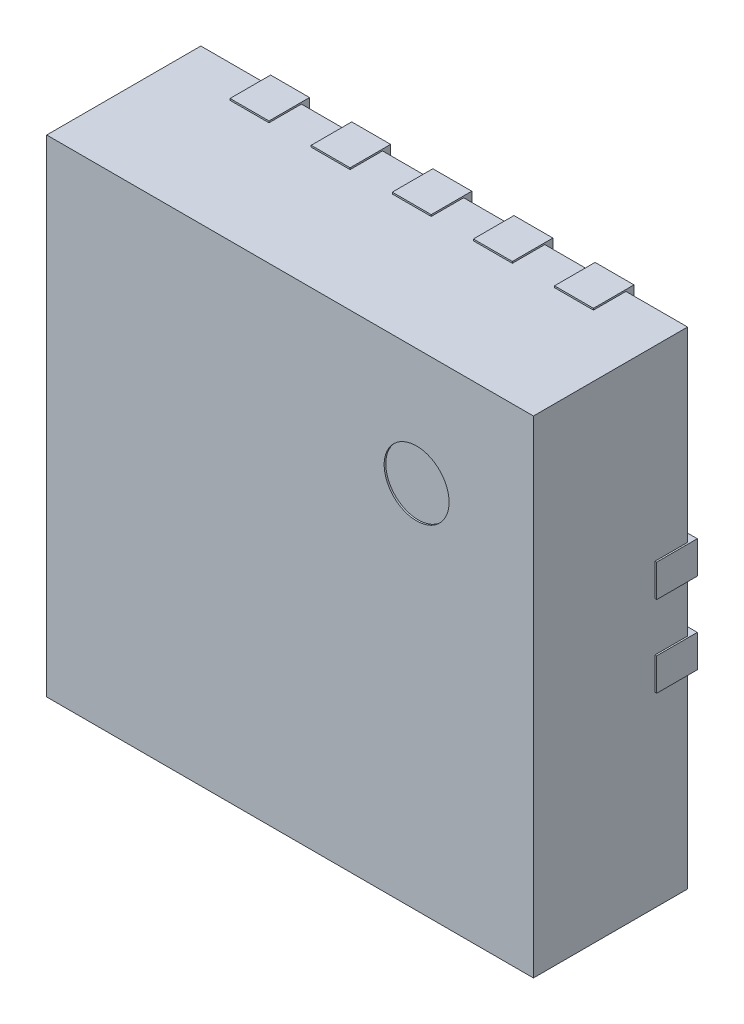
from build123d import *

# Parameters (mm, degrees)
SKETCH1_W                = 3
SKETCH1_H                = 3
BOSS_EXTRUDE1_DEPTH      = 0.95
SKETCH2_R                = 0.2
CUT_EXTRUDE1_DEPTH       = 0.01
BOSS_EXTRUDE2_DEPTH      = 0.05
BOSS_EXTRUDE2_DEPTH_BACK = 0.2
SKETCH3_W                = 0.01
SKETCH3_H                = 0.2
BOSS_EXTRUDE4_START      = -0.2
BOSS_EXTRUDE4_DEPTH      = 0.25
LPATTERN2_COUNT          = 5
LPATTERN2_PITCH          = 0.5
MIRROR2_START            = -0.2
MIRROR2_COPY_1_DEPTH     = 0.25
MIRROR2_COPY_2_DEPTH     = 0.25
MIRROR2_COPY_3_DEPTH     = 0.25
MIRROR2_COPY_4_DEPTH     = 0.25


with BuildPart() as part:
    # Sketch1 → Boss-Extrude1 (new body)
    with BuildSketch(Plane.XY):
        Rectangle(SKETCH1_W, SKETCH1_H)
    extrude(amount=BOSS_EXTRUDE1_DEPTH)

    # Sketch2 → Cut-Extrude1 (cut)
    with BuildSketch(Plane.XY.offset(0.95)):
        with Locations((0.78, 0.78)):
            Circle(SKETCH2_R)
    extrude(amount=-CUT_EXTRUDE1_DEPTH, mode=Mode.SUBTRACT)

    # Sketch3 → Boss-Extrude2 (add, two sides: drawn at the far end of the back side and taken through both)
    with BuildSketch(Plane(origin=(0, 0, 0), x_dir=(-1, 0, 0), z_dir=(0, 0, -1)).offset(-BOSS_EXTRUDE2_DEPTH_BACK)):
        with BuildLine():
            Line((1.5, 0.35), (1.2, 0.35))
            Line((1.2, 0.35), (1.2, 0.80475))
            ThreePointArc((1.2, 0.80475), (1.194068912, 0.819068912), (1.17975, 0.825))
            Line((1.17975, 0.825), (-1, 0.825))
            Line((-1, 0.825), (-1.2, 0.625))
            Line((-1.2, 0.625), (-1.2, 0.35))
            Line((-1.2, 0.35), (-1.5, 0.35))
            Line((-1.5, 0.35), (-1.5, 0.15))
            Line((-1.5, 0.15), (-1.2, 0.15))
            Line((-1.2, 0.15), (-1.2, -0.15))
            Line((-1.2, -0.15), (-1.5, -0.15))
            Line((-1.5, -0.15), (-1.5, -0.35))
            Line((-1.5, -0.35), (-1.2, -0.35))
            Line((-1.2, -0.35), (-1.2, -0.80475))
            ThreePointArc((-1.2, -0.80475), (-1.194068912, -0.819068912), (-1.17975, -0.825))
            Line((-1.17975, -0.825), (1.17975, -0.825))
            ThreePointArc((1.17975, -0.825), (1.194068912, -0.819068912), (1.2, -0.80475))
            Line((1.2, -0.80475), (1.2, -0.35))
            Line((1.2, -0.35), (1.5, -0.35))
            Line((1.5, -0.35), (1.5, -0.15))
            Line((1.5, -0.15), (1.2, -0.15))
            Line((1.2, -0.15), (1.2, 0.15))
            Line((1.2, 0.15), (1.5, 0.15))
            Line((1.5, 0.15), (1.5, 0.35))
        make_face()
        with Locations((1.505, 0.25)):
            Rectangle(SKETCH3_W, SKETCH3_H)
        with Locations((1.505, -0.25)):
            Rectangle(SKETCH3_W, SKETCH3_H)
        with Locations((-1.505, -0.25)):
            Rectangle(SKETCH3_W, SKETCH3_H)
        with Locations((-1.505, 0.25)):
            Rectangle(SKETCH3_W, SKETCH3_H)
    extrude(amount=BOSS_EXTRUDE2_DEPTH + BOSS_EXTRUDE2_DEPTH_BACK)

    # Sketch6 → Boss-Extrude4 (add)
    with BuildSketch(Plane(origin=(0, 0, 0), x_dir=(-1, 0, 0), z_dir=(0, 0, -1)).offset(BOSS_EXTRUDE4_START)):
        with BuildLine():
            Line((-1.12, 1.51), (-0.88, 1.51))
            Line((-0.88, 1.51), (-0.88, 1.5))
            Line((-0.88, 1.5), (-0.88, 1.22))
            ThreePointArc((-0.88, 1.22), (-1, 1.1), (-1.12, 1.22))
            Line((-1.12, 1.22), (-1.12, 1.5))
            Line((-1.12, 1.5), (-1.12, 1.51))
        make_face()
    boss_extrude4 = extrude(amount=BOSS_EXTRUDE4_DEPTH)

    # LPattern2: Boss-Extrude4 ×5
    with Locations(*[(-i * LPATTERN2_PITCH, 0, 0) for i in range(1, LPATTERN2_COUNT)]):
        add(boss_extrude4)

    # Mirror2: Boss-Extrude4 across plane
    add(boss_extrude4.mirror(Plane.ZX))

    # Mirror2 copy 1 sketch → Mirror2 copy 1 (add)
    with BuildSketch(Plane(origin=(-0.5, 0, 0), x_dir=(-1, 0, 0), z_dir=(0, 0, -1)).offset(MIRROR2_START)):
        with BuildLine():
            Line((-1.12, -1.51), (-0.88, -1.51))
            Line((-0.88, -1.51), (-0.88, -1.5))
            Line((-0.88, -1.5), (-0.88, -1.22))
            ThreePointArc((-0.88, -1.22), (-1, -1.1), (-1.12, -1.22))
            Line((-1.12, -1.22), (-1.12, -1.5))
            Line((-1.12, -1.5), (-1.12, -1.51))
        make_face()
    extrude(amount=MIRROR2_COPY_1_DEPTH)

    # Mirror2 copy 2 sketch → Mirror2 copy 2 (add)
    with BuildSketch(Plane(origin=(-1, 0, 0), x_dir=(-1, 0, 0), z_dir=(0, 0, -1)).offset(MIRROR2_START)):
        with BuildLine():
            Line((-1.12, -1.51), (-0.88, -1.51))
            Line((-0.88, -1.51), (-0.88, -1.5))
            Line((-0.88, -1.5), (-0.88, -1.22))
            ThreePointArc((-0.88, -1.22), (-1, -1.1), (-1.12, -1.22))
            Line((-1.12, -1.22), (-1.12, -1.5))
            Line((-1.12, -1.5), (-1.12, -1.51))
        make_face()
    extrude(amount=MIRROR2_COPY_2_DEPTH)

    # Mirror2 copy 3 sketch → Mirror2 copy 3 (add)
    with BuildSketch(Plane(origin=(-1.5, 0, 0), x_dir=(-1, 0, 0), z_dir=(0, 0, -1)).offset(MIRROR2_START)):
        with BuildLine():
            Line((-1.12, -1.51), (-0.88, -1.51))
            Line((-0.88, -1.51), (-0.88, -1.5))
            Line((-0.88, -1.5), (-0.88, -1.22))
            ThreePointArc((-0.88, -1.22), (-1, -1.1), (-1.12, -1.22))
            Line((-1.12, -1.22), (-1.12, -1.5))
            Line((-1.12, -1.5), (-1.12, -1.51))
        make_face()
    extrude(amount=MIRROR2_COPY_3_DEPTH)

    # Mirror2 copy 4 sketch → Mirror2 copy 4 (add)
    with BuildSketch(Plane(origin=(-2, 0, 0), x_dir=(-1, 0, 0), z_dir=(0, 0, -1)).offset(MIRROR2_START)):
        with BuildLine():
            Line((-1.12, -1.51), (-0.88, -1.51))
            Line((-0.88, -1.51), (-0.88, -1.5))
            Line((-0.88, -1.5), (-0.88, -1.22))
            ThreePointArc((-0.88, -1.22), (-1, -1.1), (-1.12, -1.22))
            Line((-1.12, -1.22), (-1.12, -1.5))
            Line((-1.12, -1.5), (-1.12, -1.51))
        make_face()
    extrude(amount=MIRROR2_COPY_4_DEPTH)


solid = part.part
